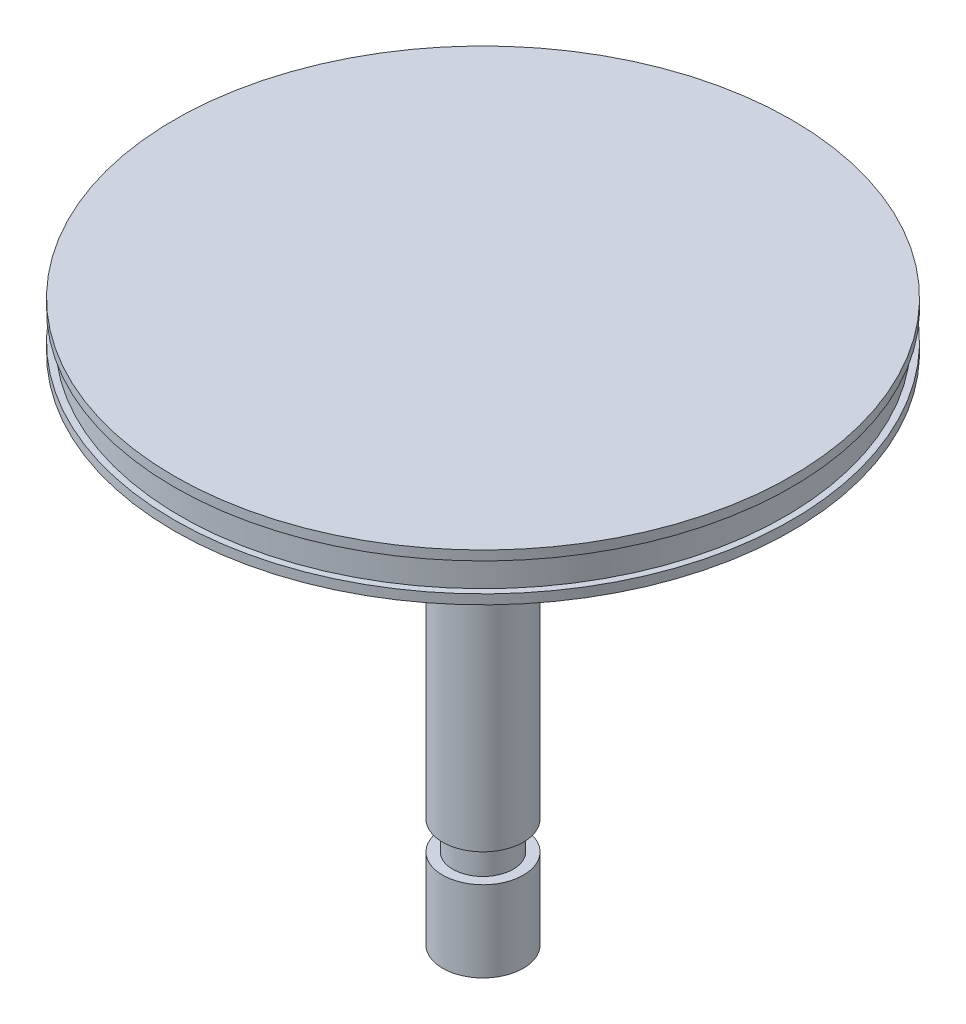
from build123d import *

# Parameters (mm, degrees)
SKETCH2_R           = 63.66
BOSS_EXTRUDE1_DEPTH = 5
SKETCH3_R           = 65
BOSS_EXTRUDE2_DEPTH = 2
SKETCH4_R           = 6.366
BOSS_EXTRUDE3_DEPTH = 108
SKETCH5_R           = 8.5
BOSS_EXTRUDE4_DEPTH = 17
SKETCH6_R           = 10
BOSS_EXTRUDE5_DEPTH = 2
BOSS_EXTRUDE6_START = 17
SKETCH7_R           = 8.5
BOSS_EXTRUDE6_DEPTH = 17
SKETCH8_R           = 8.5
BOSS_EXTRUDE7_DEPTH = 30


with BuildPart() as part:
    # Sketch2 → Boss-Extrude1 (new, symmetric)
    with BuildSketch(Plane(origin=(0, 0, 0), x_dir=(1, 0, 0), z_dir=(0, 1, 0))):
        with Locations(Location((0, 0, 0), (0, 0, 270))):
            Circle(SKETCH2_R)
    extrude(amount=BOSS_EXTRUDE1_DEPTH, both=True)

    # Sketch3 → Boss-Extrude2 (add)
    with BuildSketch(Plane.XZ.offset(5)):
        with Locations(Location((0, 0, 0), (0, 0, 270))):
            Circle(SKETCH3_R)
    boss_extrude2 = extrude(amount=-BOSS_EXTRUDE2_DEPTH)

    # Mirror1: Boss-Extrude2 across plane
    add(boss_extrude2.mirror(Plane.ZX))

    # Sketch4 → Boss-Extrude3 (add)
    with BuildSketch(Plane.XZ.offset(5)):
        with Locations(Location((0, 0, 0), (0, 0, 90))):
            Circle(SKETCH4_R)
    extrude(amount=BOSS_EXTRUDE3_DEPTH)

    # Sketch5 → Boss-Extrude4 (add)
    with BuildSketch(Plane.XZ.offset(113)):
        with Locations(Location((0, 0, 0), (0, 0, 270))):
            Circle(SKETCH5_R)
    extrude(amount=-BOSS_EXTRUDE4_DEPTH)

    # Sketch6 → Boss-Extrude5 (add)
    with BuildSketch(Plane.XZ.offset(5)):
        with Locations(Location((0, 0, 0), (0, 0, 90))):
            Circle(SKETCH6_R)
    extrude(amount=BOSS_EXTRUDE5_DEPTH)

    # Sketch7 → Boss-Extrude6 (add)
    with BuildSketch(Plane.XZ.offset(7).offset(BOSS_EXTRUDE6_START)):
        with Locations(Location((0, 0, 0), (0, 0, 270))):
            Circle(SKETCH7_R)
    extrude(amount=-BOSS_EXTRUDE6_DEPTH)

    # Sketch8 → Boss-Extrude7 (add, symmetric)
    with BuildSketch(Plane(origin=(0, -60, 0), x_dir=(-1, 0, 0), z_dir=(0, -1, 0))):
        with Locations(Location((0, 0, 0), (0, 0, 90))):
            Circle(SKETCH8_R)
    extrude(amount=BOSS_EXTRUDE7_DEPTH, both=True)


solid = part.part
